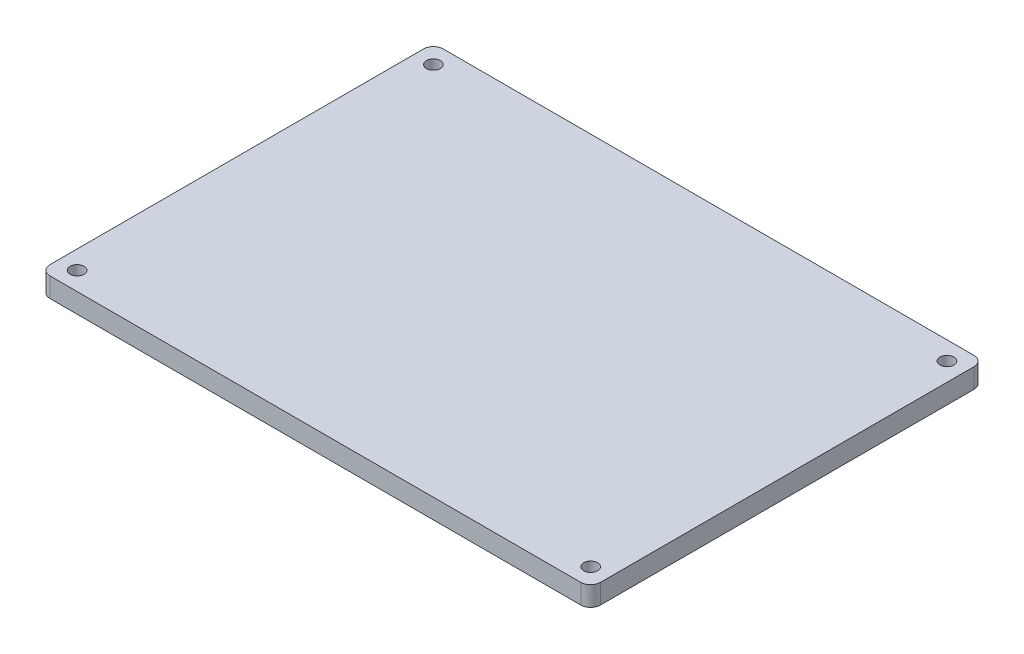
from build123d import *

# Parameters (mm, degrees)
BOSS_EXTRUDE1_DEPTH                             = 6.35
CSK_FOR_M4_FLAT_HEAD_MACHINE_SCREW1_D           = 4.5
CSK_FOR_M4_FLAT_HEAD_MACHINE_SCREW1_CSINK_D     = 9.4
CSK_FOR_M4_FLAT_HEAD_MACHINE_SCREW1_CSINK_ANGLE = 90


with BuildPart() as part:
    # Sketch1 → Boss-Extrude1 (new body)
    with BuildSketch(Plane.XZ.offset(-670.601916524)):
        with BuildLine():
            Line((-77.171622513, -143.293254717), (94.278377487, -143.293254717))
            ThreePointArc((94.278377487, -143.293254717), (96.523441517, -144.223190687), (97.453377487, -146.468254717))
            Line((97.453377487, -146.468254717), (97.453377487, -267.118254717))
            ThreePointArc((97.453377487, -267.118254717), (96.523441517, -269.363318747), (94.278377487, -270.293254717))
            Line((94.278377487, -270.293254717), (-77.171622513, -270.293254717))
            ThreePointArc((-77.171622513, -270.293254717), (-79.416686543, -269.363318747), (-80.346622513, -267.118254717))
            Line((-80.346622513, -267.118254717), (-80.346622513, -146.468254717))
            ThreePointArc((-80.346622513, -146.468254717), (-79.416686543, -144.223190687), (-77.171622513, -143.293254717))
        make_face()
    extrude(amount=BOSS_EXTRUDE1_DEPTH)

    # CSK for M4 Flat Head Machine Screw1 (through all)
    with Locations(Plane(origin=(0, 664.251916524, 0), x_dir=(-1, 0, 0), z_dir=(0, -1, 0))):
        with Locations((-91.500252487, 149.246379717), (-91.500252487, 264.340129717), (74.393497513, 264.340129717), (74.393497513, 149.246379717)):
            CounterSinkHole(CSK_FOR_M4_FLAT_HEAD_MACHINE_SCREW1_D / 2, CSK_FOR_M4_FLAT_HEAD_MACHINE_SCREW1_CSINK_D / 2, counter_sink_angle=CSK_FOR_M4_FLAT_HEAD_MACHINE_SCREW1_CSINK_ANGLE)


solid = part.part
